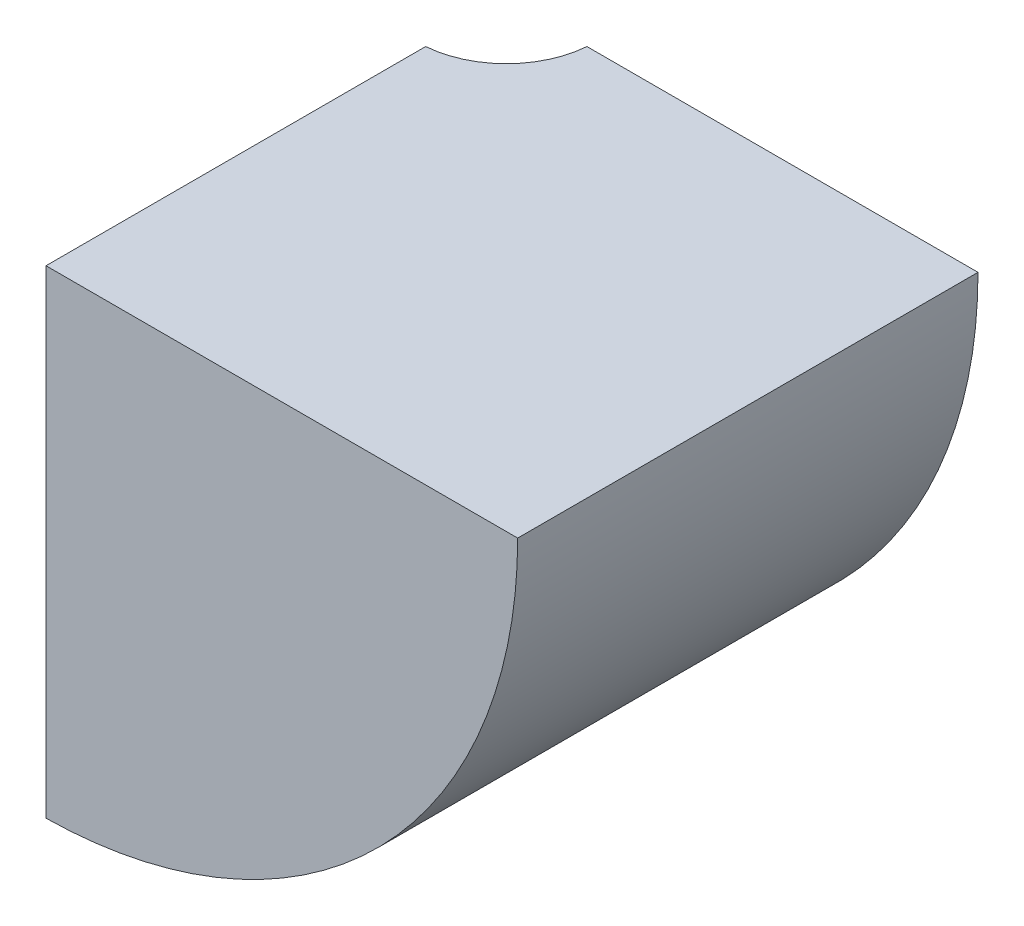
from build123d import *

# Parameters (mm, degrees)
SKETCH1_R           = 42
BOSS_EXTRUDE1_DEPTH = 41
CUT_EXTRUDE1_DEPTH  = 73.173402303
SKETCH3_R           = 7.7
CUT_EXTRUDE2_DEPTH  = 73.173402303
SKETCH4_W           = 0.6
SKETCH4_H           = 34.211954595
SKETCH4_W_2         = 35.741543893
SKETCH4_H_2         = 0.6
CUT_EXTRUDE3_DEPTH  = 73.173402476


with BuildPart() as part:
    # Sketch1 → Boss-Extrude1 (new body)
    with BuildSketch(Plane.XY):
        Circle(SKETCH1_R)
    extrude(amount=BOSS_EXTRUDE1_DEPTH)

    # Sketch2 → Cut-Extrude1 (cut, through all)
    with BuildSketch(Plane.XY.offset(41)):
        with BuildLine():
            Line((0, 0), (42, 0))
            ThreePointArc((42, 0), (-29.69848481, 29.69848481), (0, -42))
            Line((0, -42), (0, 0))
        make_face()
    extrude(amount=-CUT_EXTRUDE1_DEPTH, mode=Mode.SUBTRACT)

    # Sketch3 → Cut-Extrude2 (cut, through all)
    with BuildSketch(Plane(origin=(0, 0, 0), x_dir=(1, 0, 0), z_dir=(0, 1, 0))):
        Circle(SKETCH3_R)
    extrude(amount=-CUT_EXTRUDE2_DEPTH, mode=Mode.SUBTRACT)

    # Sketch4 → Cut-Extrude3 (cut, through all)
    with BuildSketch(Plane(origin=(0, 0, 0), x_dir=(1, 0, 0), z_dir=(0, 1, 0))):
        with Locations((0.3, -23.894022702)):
            Rectangle(SKETCH4_W, SKETCH4_H)
        with Locations((24.129228054, -0.3)):
            Rectangle(SKETCH4_W_2, SKETCH4_H_2)
    extrude(amount=-CUT_EXTRUDE3_DEPTH, mode=Mode.SUBTRACT)


solid = part.part
